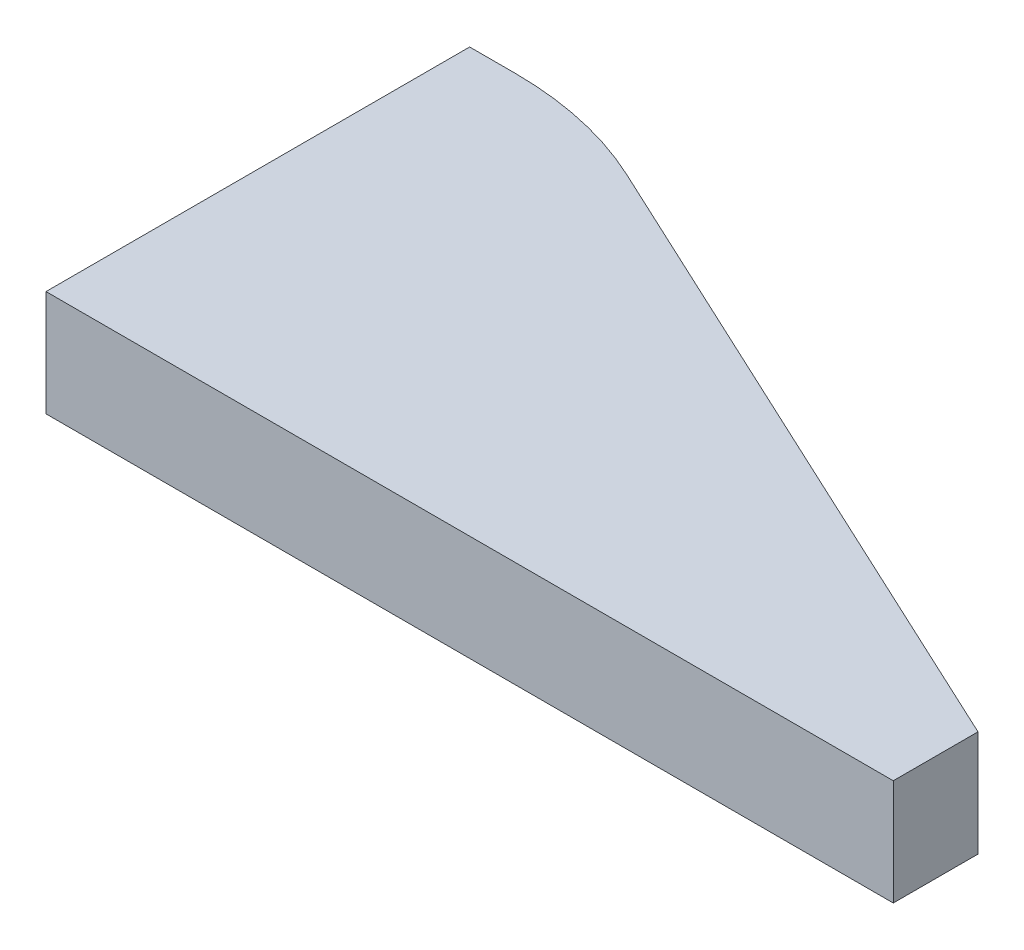
from build123d import *

# Parameters (mm, degrees)
SKETCH1_W           = 25.4
SKETCH1_H           = 12.7
BOSS_EXTRUDE1_DEPTH = 3.175
CHAMFER1_SIZE       = 10.16
CHAMFER1_SIZE2      = 21.788190312
FILLET1_R           = 10.16


with BuildPart() as part:
    # Sketch1 → Boss-Extrude1 (new body)
    with BuildSketch(Plane(origin=(0, 0, 0), x_dir=(1, 0, 0), z_dir=(0, 1, 0))):
        with Locations((12.7, 6.35)):
            Rectangle(SKETCH1_W, SKETCH1_H)
    extrude(amount=BOSS_EXTRUDE1_DEPTH)

    # Chamfer1
    chamfer1_edges = [part.edges().sort_by_distance(p)[0] for p in [
        (25.4, 1.5875, -12.7),
    ]]
    chamfer1_side = [part.faces().sort_by_distance(p)[0] for p in [
        (25.4, 1.5875, -6.35),
    ]]
    chamfer(chamfer1_edges, length=CHAMFER1_SIZE, length2=CHAMFER1_SIZE2, reference=chamfer1_side[0])

    # Fillet1
    fillet1_edges = [part.edges().sort_by_distance(p)[0] for p in [
        (3.611809688, 1.5875, -12.7),
    ]]
    fillet(fillet1_edges, radius=FILLET1_R)


solid = part.part
